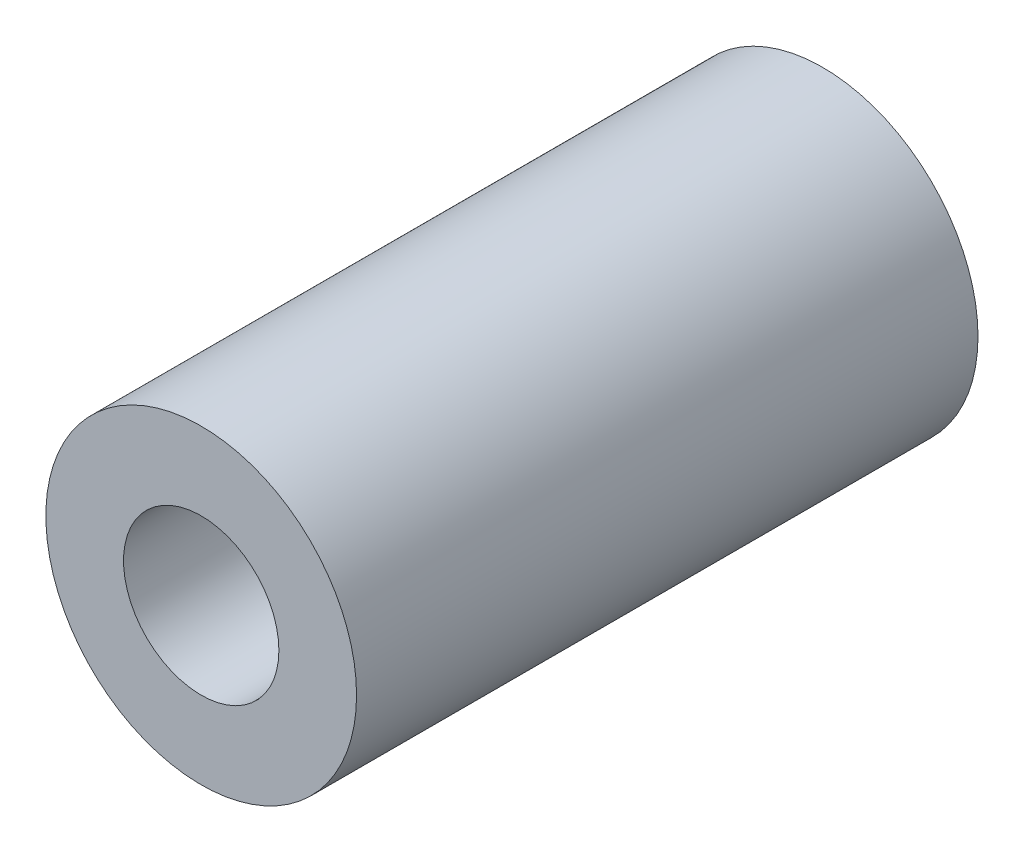
from build123d import *

# Parameters (mm, degrees)
SKETCH1_R           = 10
SKETCH1_R_2         = 5
BOSS_EXTRUDE1_DEPTH = 20


with BuildPart() as part:
    # Sketch1 → Boss-Extrude1 (new, symmetric)
    with BuildSketch(Plane.XY):
        Circle(SKETCH1_R)
        Circle(SKETCH1_R_2, mode=Mode.SUBTRACT)
    extrude(amount=BOSS_EXTRUDE1_DEPTH, both=True)


solid = part.part
